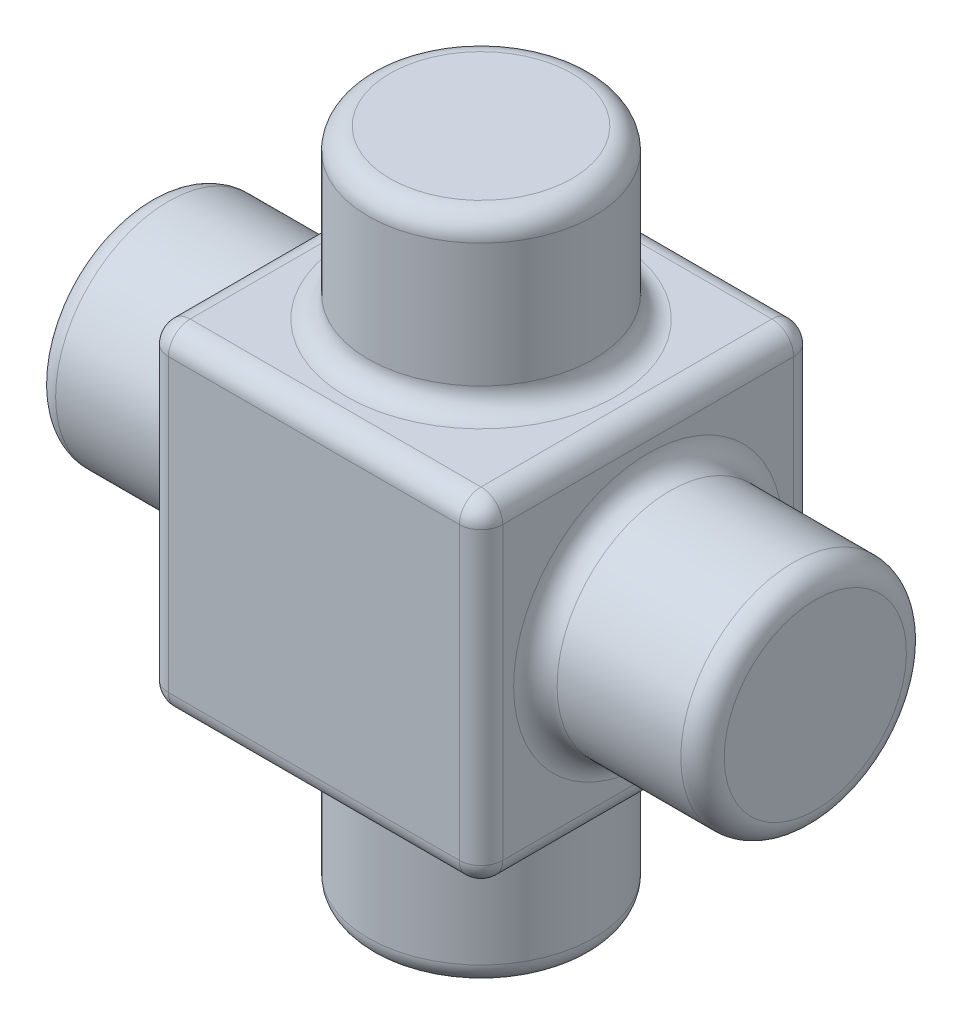
from build123d import *

# Parameters (mm, degrees)
SKETCH1_W           = 50.8
SKETCH1_H           = 50.8
BOSS_EXTRUDE1_DEPTH = 25.4
SKETCH1_3_R         = 17.145
BOSS_EXTRUDE2_DEPTH = 50.8
FILLET1_R           = 3.302


with BuildPart() as part:
    # Sketch1 → Boss-Extrude1 (new, symmetric)
    with BuildSketch(Plane(origin=(0, 0, 0), x_dir=(1, 0, 0), z_dir=(0, 1, 0))):
        Rectangle(SKETCH1_W, SKETCH1_H)
    extrude(amount=BOSS_EXTRUDE1_DEPTH, both=True)

    # Sketch1<3> → Boss-Extrude2 (add, symmetric)
    with BuildSketch(Plane(origin=(0, 0, 0), x_dir=(1, 0, 0), z_dir=(0, 1, 0))):
        Circle(SKETCH1_3_R)
    boss_extrude2 = extrude(amount=BOSS_EXTRUDE2_DEPTH, both=True)

    # Mirror1: Boss-Extrude2 across plane
    add(boss_extrude2.mirror(Plane(origin=(0, 0, 0), x_dir=(0, 0, 1), z_dir=(-0.7071067811865475, 0.7071067811865476, 0))))

    # Fillet1
    fillet1_edges = [part.edges().sort_by_distance(p)[0] for p in [
        (-17.145, -50.8, 0),
        (50.8, -17.145, 0),
        (-17.145, 50.8, 0),
        (-50.8, -17.145, 0),
        (-17.145, -25.4, 0),
        (-25.4, -25.4, 0),
        (-25.4, -17.145, 0),
        (-25.4, 0, -25.4),
        (0, -25.4, -25.4),
        (25.4, 0, -25.4),
        (25.4, -25.4, 0),
        (25.4, -17.145, 0),
        (-25.4, 25.4, 0),
        (0, 25.4, -25.4),
        (25.4, 25.4, 0),
        (-17.145, 25.4, 0),
        (-25.4, 0, 25.4),
        (0, 25.4, 25.4),
        (25.4, 0, 25.4),
        (0, -25.4, 25.4),
    ]]
    fillet(fillet1_edges, radius=FILLET1_R)


solid = part.part
